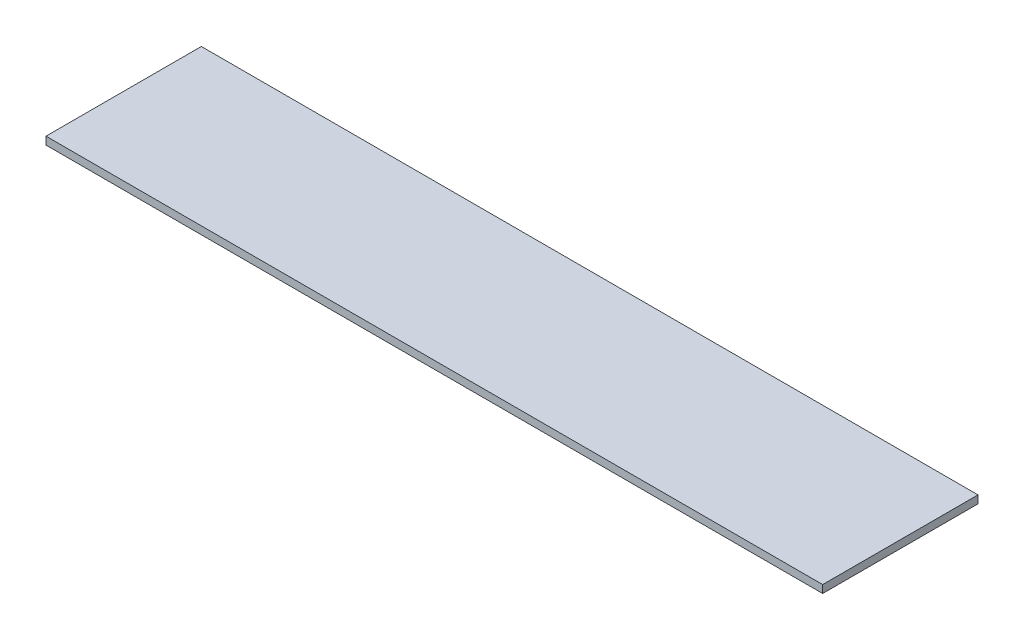
from build123d import *

# Parameters (mm, degrees)
SKETCH1_W           = 200
SKETCH1_H           = 40
BOSS_EXTRUDE1_DEPTH = 2


with BuildPart() as part:
    # Sketch1 → Boss-Extrude1 (new body)
    with BuildSketch(Plane(origin=(0, 0, 0), x_dir=(1, 0, 0), z_dir=(0, 1, 0))):
        Rectangle(SKETCH1_W, SKETCH1_H)
    extrude(amount=BOSS_EXTRUDE1_DEPTH)


solid = part.part
